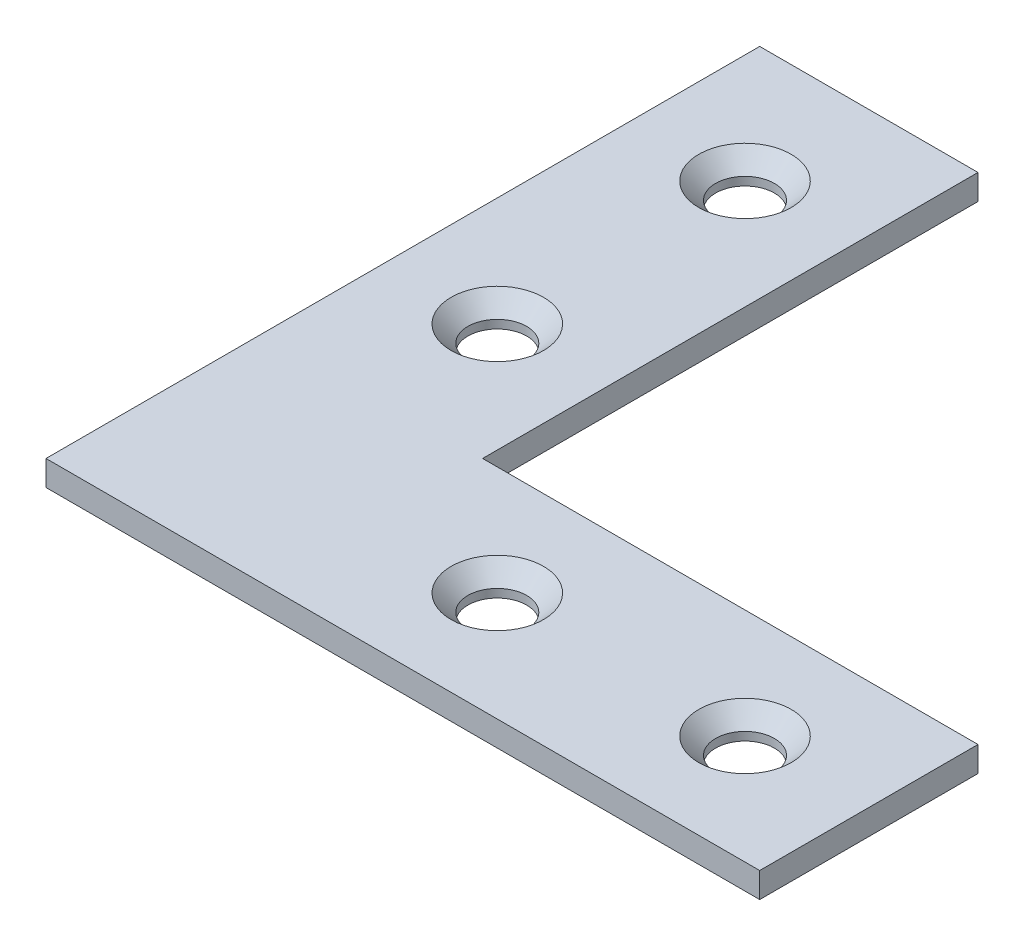
from build123d import *

# Parameters (mm, degrees)
SKETCH1_R           = 1.75
BOSS_EXTRUDE1_DEPTH = 1.5
CHAMFER1_SIZE       = 1


with BuildPart() as part:
    # Sketch1 → Boss-Extrude1 (new body)
    with BuildSketch(Plane(origin=(0, 0, 0), x_dir=(1, 0, 0), z_dir=(0, 1, 0))):
        Polygon((0, 0), (29.5, 0), (29.5, -13), (-13, -13), (-13, 29.5), (0, 29.5), align=None)
        with Locations(Location((-6.5, 7.375, 0), (0, 0, 270))):
            Circle(SKETCH1_R, mode=Mode.SUBTRACT)
        with Locations(Location((7.375, -6.5, 0), (0, 0, 270))):
            Circle(SKETCH1_R, mode=Mode.SUBTRACT)
        with Locations(Location((-6.5, 22.125, 0), (0, 0, 90))):
            Circle(SKETCH1_R, mode=Mode.SUBTRACT)
        with Locations(Location((22.125, -6.5, 0), (0, 0, 90))):
            Circle(SKETCH1_R, mode=Mode.SUBTRACT)
    extrude(amount=BOSS_EXTRUDE1_DEPTH)

    # Chamfer1
    chamfer1_edges = [part.edges().sort_by_distance(p)[0] for p in [
        (-6.5, 1.5, -9.125),
        (7.375, 1.5, 4.75),
        (-6.5, 1.5, -20.375),
        (22.125, 1.5, 8.25),
    ]]
    chamfer(chamfer1_edges, length=CHAMFER1_SIZE)


solid = part.part
